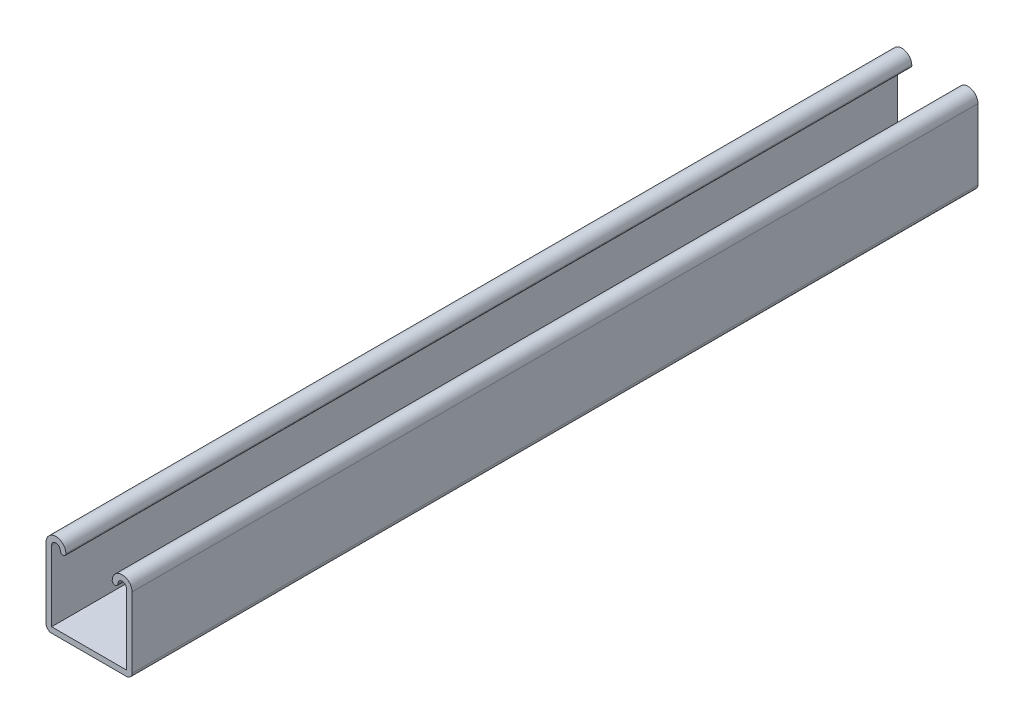
from build123d import *

# Parameters (mm, degrees)
EXTRUDE_1_DEPTH     = 406.4
SKETCH_2_R          = 7.112
CUT_EXTRUDE_1_DEPTH = 411.319677278


with BuildPart() as part:
    # 草图1 → 凸台-拉伸1 (new body)
    with BuildSketch(Plane.XY):
        with BuildLine():
            Line((0, 0), (35.98, 0))
            ThreePointArc((35.98, 0), (37.883814298, 0.788585702), (38.6724, 2.6924))
            Line((38.6724, 2.6924), (38.6724, 36.5252))
            ThreePointArc((38.6724, 36.5252), (33.8972, 41.3004), (29.122, 36.5252))
            ThreePointArc((29.122, 36.5252), (30.4682, 35.179), (31.8144, 36.5252))
            ThreePointArc((31.8144, 36.5252), (33.8972, 38.608), (35.98, 36.5252))
            Line((35.98, 36.5252), (35.98, 2.6924))
            Line((35.98, 2.6924), (0, 2.6924))
            Line((0, 2.6924), (0, 36.5252))
            ThreePointArc((0, 36.5252), (2.0828, 38.608), (4.1656, 36.5252))
            ThreePointArc((4.1656, 36.5252), (5.5118, 35.179), (6.858, 36.5252))
            ThreePointArc((6.858, 36.5252), (2.0828, 41.3004), (-2.6924, 36.5252))
            Line((-2.6924, 36.5252), (-2.6924, 2.6924))
            ThreePointArc((-2.6924, 2.6924), (-1.903814298, 0.788585702), (0, 0))
        make_face()
    extrude(amount=EXTRUDE_1_DEPTH)

    # 草图2 → 切除-拉伸1 (cut, through all)
    with BuildSketch(Plane(origin=(0, 0, 0), x_dir=(-1, 0, 0), z_dir=(0, -1, 0))):
        with Locations(Location((-17.99, -120.65, 0), (0, 0, 90))):
            Circle(SKETCH_2_R)
        with Locations(Location((-17.99, -285.75, 0), (0, 0, 90))):
            Circle(SKETCH_2_R)
    extrude(amount=-CUT_EXTRUDE_1_DEPTH, mode=Mode.SUBTRACT)


solid = part.part
